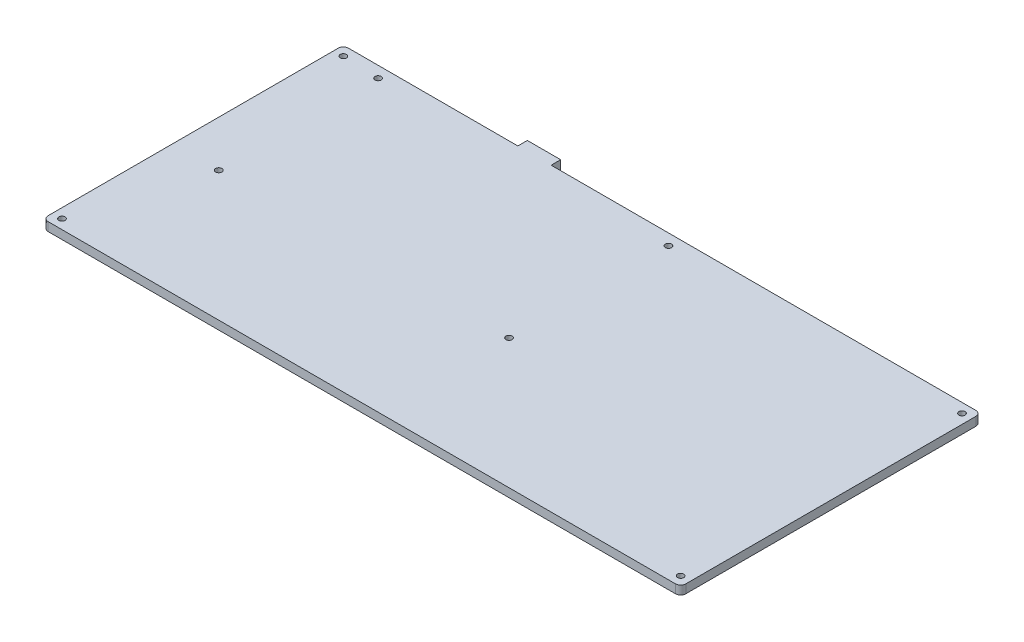
from build123d import *

# Parameters (mm, degrees)
SALIENTE_EXTRUIR1_DEPTH                              = 2.5
REDONDEO1_R                                          = 1.5
CSK_FOR_M1_6_COUNTERSUNK_FLAT_HEAD_SCREW_D           = 1.8
CSK_FOR_M1_6_COUNTERSUNK_FLAT_HEAD_SCREW_CSINK_D     = 3.6
CSK_FOR_M1_6_COUNTERSUNK_FLAT_HEAD_SCREW_CSINK_ANGLE = 90


with BuildPart() as part:
    # Croquis1 → Saliente-Extruir1 (new body)
    with BuildSketch(Plane(origin=(0, 0, 0), x_dir=(1, 0, 0), z_dir=(0, 1, 0))):
        Polygon((-90.389050604, -43.256388366), (94.110949396, -43.256388366), (94.110949396, 43.657904704), (-30.269137665, 43.657904704), (-30.269137665, 46.407904704), (-39.909137665, 46.407904704), (-39.909137665, 43.657904704), (-90.389050604, 43.657904704), align=None)
    extrude(amount=SALIENTE_EXTRUIR1_DEPTH)

    # Redondeo1
    redondeo1_edges = [part.edges().sort_by_distance(p)[0] for p in [
        (-90.389050604, 1.25, 43.256388366),
        (-90.389050604, 1.25, -43.657904704),
        (94.110949396, 1.25, -43.657904704),
        (94.110949396, 1.25, 43.256388366),
    ]]
    fillet(redondeo1_edges, radius=REDONDEO1_R)

    # CSK for M1.6 Countersunk Flat Head Screw1 (through all)
    with Locations(Plane(origin=(-87.639050604, 0, 40.506388366), x_dir=(0, 0, -1), z_dir=(0, -1, 0))):
        with Locations((0, 0), (0, 179), (81.41429307, 179), (81.41429307, 0), (34.81029307, 10.55), (34.81029307, 94.55), (80.91429307, 94.55), (80.91429307, 10.55)):
            CounterSinkHole(CSK_FOR_M1_6_COUNTERSUNK_FLAT_HEAD_SCREW_D / 2, CSK_FOR_M1_6_COUNTERSUNK_FLAT_HEAD_SCREW_CSINK_D / 2, counter_sink_angle=CSK_FOR_M1_6_COUNTERSUNK_FLAT_HEAD_SCREW_CSINK_ANGLE)


solid = part.part
